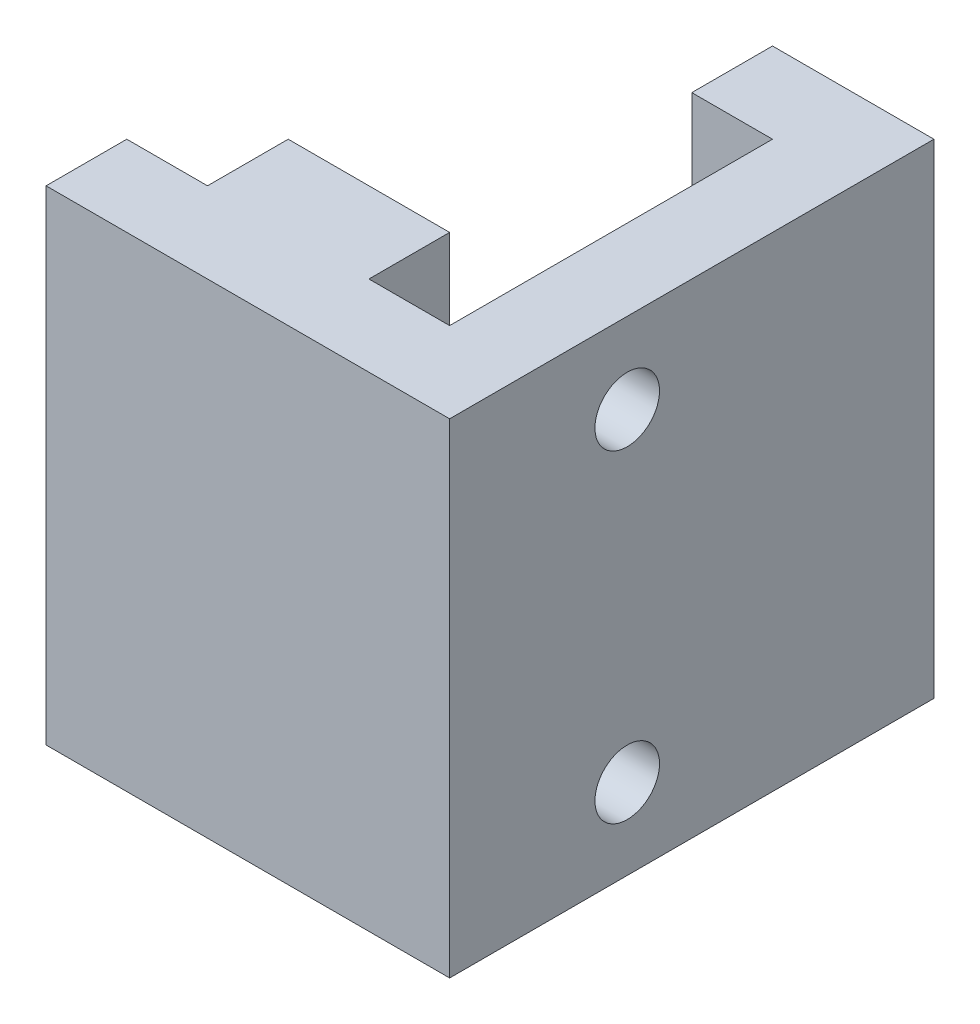
from build123d import *

# Parameters (mm, degrees)
BOSS_EXTRUDE1_DEPTH = 30
SKETCH2_R           = 2
CUT_EXTRUDE1_DEPTH  = 3


with BuildPart() as part:
    # Sketch1 → Boss-Extrude1 (new body)
    with BuildSketch(Plane(origin=(0, 0, 0), x_dir=(1, 0, 0), z_dir=(0, 1, 0))):
        Polygon((0, 5), (0, 0), (25, 0), (25, 30), (15, 30), (15, 25), (20, 25), (20, 5), (15, 5), (15, 10), (5, 10), (5, 5), align=None)
    extrude(amount=BOSS_EXTRUDE1_DEPTH)

    # Sketch2 → Cut-Extrude1 (cut)
    with BuildSketch(Plane(origin=(25, 0, 0), x_dir=(0, 0, -1), z_dir=(1, 0, 0))):
        with Locations((11, 25)):
            Circle(SKETCH2_R)
        with Locations((11, 5)):
            Circle(SKETCH2_R)
    extrude(amount=-CUT_EXTRUDE1_DEPTH, mode=Mode.SUBTRACT)


solid = part.part
